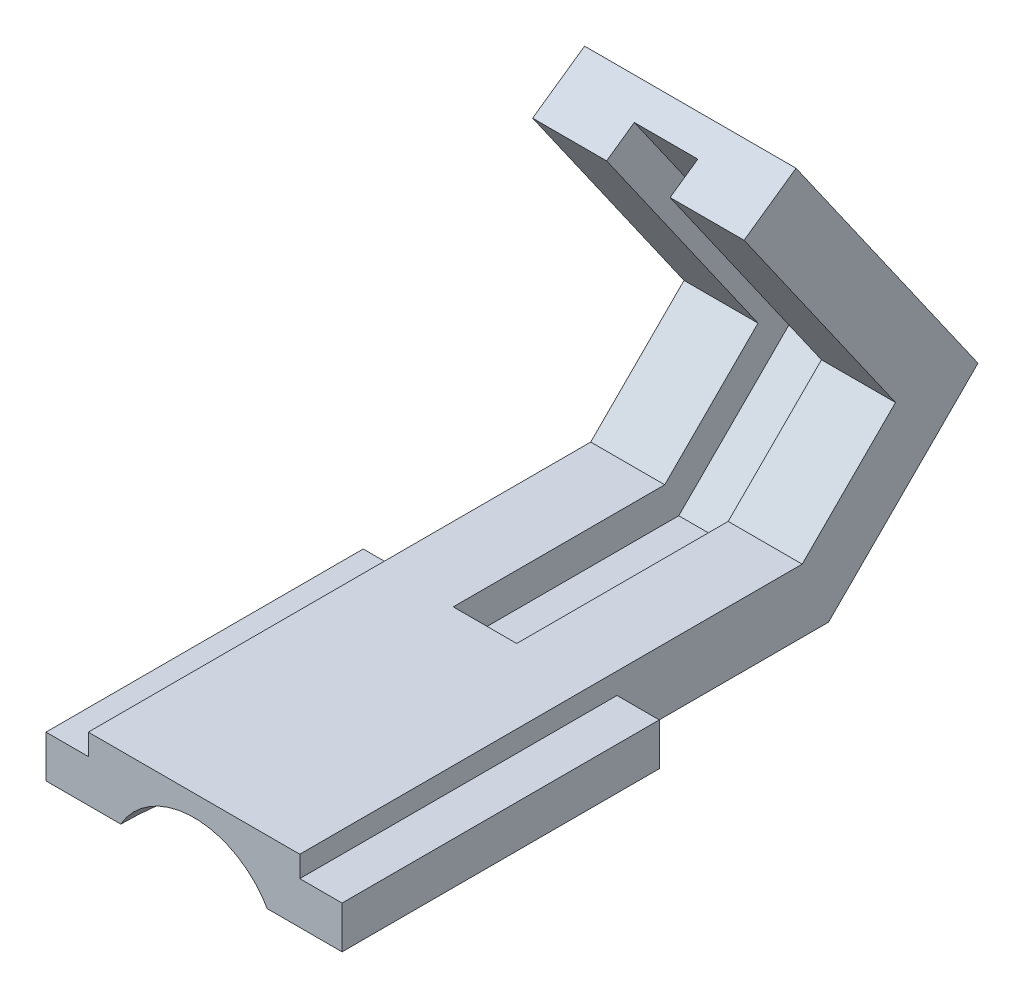
from build123d import *

# Parameters (mm, degrees)
BOSS_EXTRUDE2_DEPTH = 25
CUT_EXTRUDE1_DEPTH  = 7.5
SKETCH4_W           = 10
SKETCH4_H           = 75
BOSS_EXTRUDE3_DEPTH = 10


with BuildPart() as part:
    # Sketch2 → Boss-Extrude2 (new, symmetric)
    with BuildSketch(Plane(origin=(0, 0, 0), x_dir=(0, 0, -1), z_dir=(1, 0, 0))):
        Polygon((0, 0), (125, 0), (160.355339059, 35.355339059), (117.337106333, 96.791742381), (105.049825669, 88.188095836), (140.848741752, 37.061945188), (118.786796564, 15), (0, 15), align=None)
    extrude(amount=BOSS_EXTRUDE2_DEPTH, both=True)

    # Sketch3 → Cut-Extrude1 (cut, symmetric)
    with BuildSketch(Plane(origin=(0, 0, 0), x_dir=(0, 0, -1), z_dir=(1, 0, 0))):
        Polygon((111.603042023, 92.776707327), (151.252260316, 36.151755253), (122.100505063, 7), (68.786796564, 7), (68.786796564, 15), (118.786796564, 15), (140.848741752, 37.061945188), (105.049825669, 88.188095836), align=None)
    extrude(amount=CUT_EXTRUDE1_DEPTH, both=True, mode=Mode.SUBTRACT)

    # Sketch4 → Boss-Extrude3 (add)
    with BuildSketch(Plane(origin=(0, 0, 0), x_dir=(1, 0, 0), z_dir=(0, 1, 0))):
        with Locations((-30, 37.5)):
            Rectangle(SKETCH4_W, SKETCH4_H)
        with Locations((30, 37.5)):
            Rectangle(SKETCH4_W, SKETCH4_H)
    extrude(amount=BOSS_EXTRUDE3_DEPTH)

    # Sketch8 → Cut-Revolve5 (revolve, cut)
    with BuildSketch(Plane(origin=(0, 0, 0), x_dir=(0, 0, -1), z_dir=(1, 0, 0))):
        with BuildLine():
            Line((0, 0), (0, 10))
            ThreePointArc((0, 10), (19.364916731, 7.456883731), (37.416573868, 0))
            Line((37.416573868, 0), (0, 0))
        make_face()
    revolve(axis=Axis((0, -10, 0), (0, 0, -1)), mode=Mode.SUBTRACT)


solid = part.part
